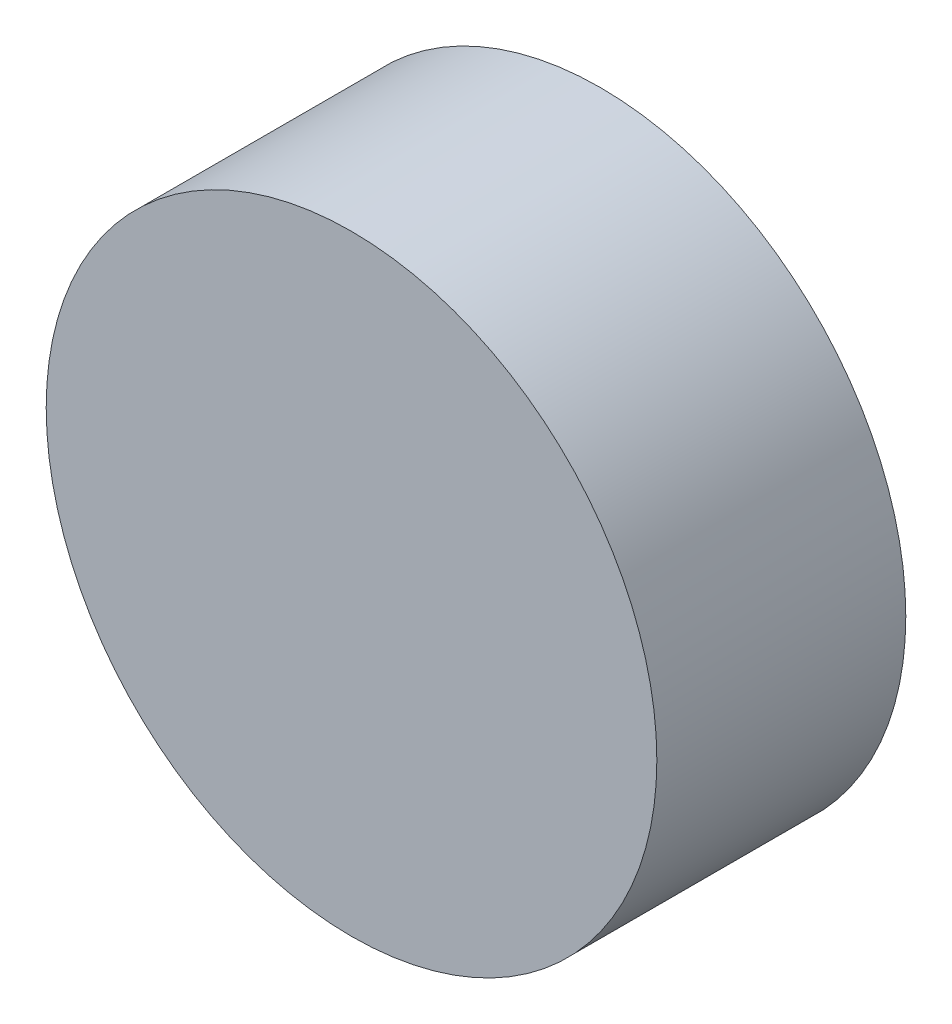
from build123d import *

# Parameters (mm, degrees)
SKETCH_1_R      = 32.5
EXTRUDE_1_DEPTH = 26.5


with BuildPart() as part:
    # 草图1 → 凸台-拉伸1 (new body)
    with BuildSketch(Plane.XY):
        Circle(SKETCH_1_R)
    extrude(amount=EXTRUDE_1_DEPTH)


solid = part.part
